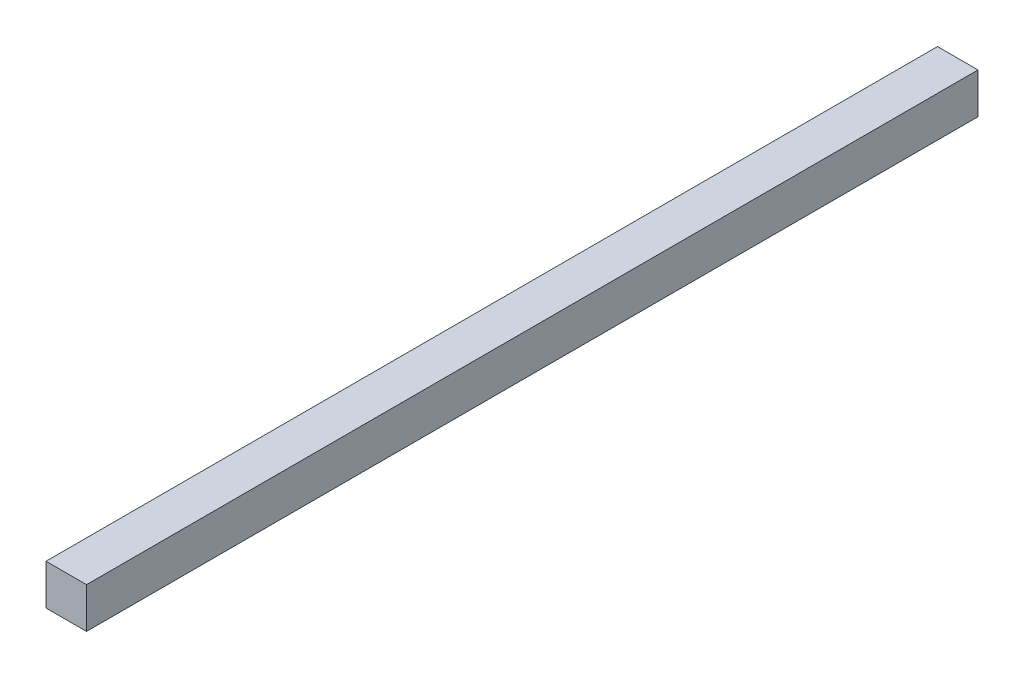
from build123d import *

# Parameters (mm, degrees)
PRESS_KOVA_KIZAGI_SAG_1_START = -60
SKETCH1_W                     = 20
SKETCH1_H                     = 20
PRESS_KOVA_KIZAGI_SAG_1_DEPTH = 440


with BuildPart() as part:
    # Sketch1 → PRESS_kova_kizagi_sag_1 (new body)
    with BuildSketch(Plane.XY.offset(PRESS_KOVA_KIZAGI_SAG_1_START)):
        with Locations((340, 1310)):
            Rectangle(SKETCH1_W, SKETCH1_H)
    extrude(amount=-PRESS_KOVA_KIZAGI_SAG_1_DEPTH)


solid = part.part
